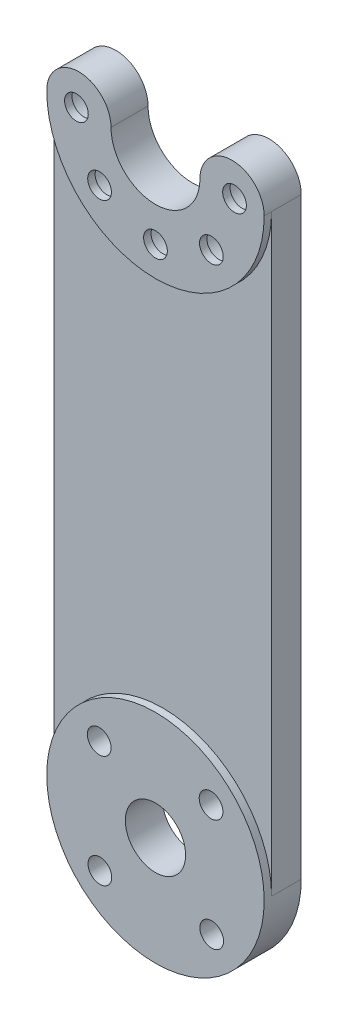
from build123d import *

# Parameters (mm, degrees)
RESSALTO_EXTRUS_O1_DEPTH                             = 0.75
RESSALTO_EXTRUS_O2_DEPTH                             = 3
REBAIXO_PARA_SHCS_M21_D                              = 2.4
REBAIXO_PARA_SHCS_M21_CBORE_D                        = 4.4
REBAIXO_PARA_SHCS_M21_CBORE_DEPTH                    = 3
RESSALTO_EXTRUS_O3_START                             = 0.75
ESBO_O4_R                                            = 11
RESSALTO_EXTRUS_O3_DEPTH                             = 0.75
ESBO_O5_R                                            = 3.05
CORTE_EXTRUS_O1_DEPTH                                = 72.944857356
REBAIXO_PARA_PARAFUSO_COM_CABE_A_REDONDA_D           = 2.4
REBAIXO_PARA_PARAFUSO_COM_CABE_A_REDONDA_CBORE_D     = 4.4
REBAIXO_PARA_PARAFUSO_COM_CABE_A_REDONDA_CBORE_DEPTH = 1.4
PADR_OCIRCULAR1_COUNT                                = 4


with BuildPart() as part:
    # Esboço1 → Ressalto-extrusão1 (new body)
    with BuildSketch(Plane.XY):
        with BuildLine():
            ThreePointArc((-4.5, 0), (0, -4.5), (4.5, 0))
            ThreePointArc((4.5, 0), (7.75, 3.25), (11, 0))
            ThreePointArc((11, 0), (0, -11), (-11, 0))
            ThreePointArc((-11, 0), (-7.75, 3.25), (-4.5, 0))
        make_face()
    extrude(amount=-RESSALTO_EXTRUS_O1_DEPTH)

    # Esboço3 → Ressalto-extrusão2 (add)
    with BuildSketch(Plane(origin=(0, 0, -0.75), x_dir=(-1, 0, 0), z_dir=(0, 0, -1))):
        with BuildLine():
            Line((-11, 0), (-11, -60))
            ThreePointArc((-11, -60), (0, -71), (11, -60))
            Line((11, -60), (11, 0))
            ThreePointArc((11, 0), (7.75, 3.25), (4.5, 0))
            ThreePointArc((4.5, 0), (0, -4.5), (-4.5, 0))
            ThreePointArc((-4.5, 0), (-7.75, 3.25), (-11, 0))
        make_face()
    extrude(amount=RESSALTO_EXTRUS_O2_DEPTH)

    # Rebaixo para SHCS M21 (through all)
    with Locations(Plane(origin=(0, 0, -3.75), x_dir=(-1, 0, 0), z_dir=(0, 0, -1))):
        with Locations((-8, 0), (-5.656854249, -5.656854249), (0, -8), (5.656854249, -5.656854249), (8, 0)):
            CounterBoreHole(REBAIXO_PARA_SHCS_M21_D / 2, REBAIXO_PARA_SHCS_M21_CBORE_D / 2, REBAIXO_PARA_SHCS_M21_CBORE_DEPTH)

    # Esboço4 → Ressalto-extrusão3 (add)
    with BuildSketch(Plane.XY.offset(-0.75).offset(RESSALTO_EXTRUS_O3_START)):
        with Locations((0, -60)):
            Circle(ESBO_O4_R)
    extrude(amount=-RESSALTO_EXTRUS_O3_DEPTH)

    # Esboço5 → Corte-extrusão1 (cut, through all)
    with BuildSketch(Plane(origin=(0, 0, -3.75), x_dir=(-1, 0, 0), z_dir=(0, 0, -1))):
        with Locations((0, -60)):
            Circle(ESBO_O5_R)
    extrude(amount=-CORTE_EXTRUS_O1_DEPTH, mode=Mode.SUBTRACT)

    # Rebaixo para parafuso com cabeça redonda de M21 (through all)
    with Locations(Plane(origin=(0, 0, -3.75), x_dir=(-1, 0, 0), z_dir=(0, 0, -1))):
        with Locations((5.624741587, -65.688785642)):
            rebaixo_para_parafuso_com_cabe_a_redonda = CounterBoreHole(REBAIXO_PARA_PARAFUSO_COM_CABE_A_REDONDA_D / 2, REBAIXO_PARA_PARAFUSO_COM_CABE_A_REDONDA_CBORE_D / 2, REBAIXO_PARA_PARAFUSO_COM_CABE_A_REDONDA_CBORE_DEPTH)

    # PadrãoCircular1: Rebaixo para parafuso com cabeça redonda de M21 ×4 about axis
    padr_ocircular1_axis = Axis((0, -60, 0), (0, 0, 1))
    for i in range(1, PADR_OCIRCULAR1_COUNT):
        add(rebaixo_para_parafuso_com_cabe_a_redonda.rotate(padr_ocircular1_axis, i * 360 / PADR_OCIRCULAR1_COUNT), mode=Mode.SUBTRACT)


solid = part.part
